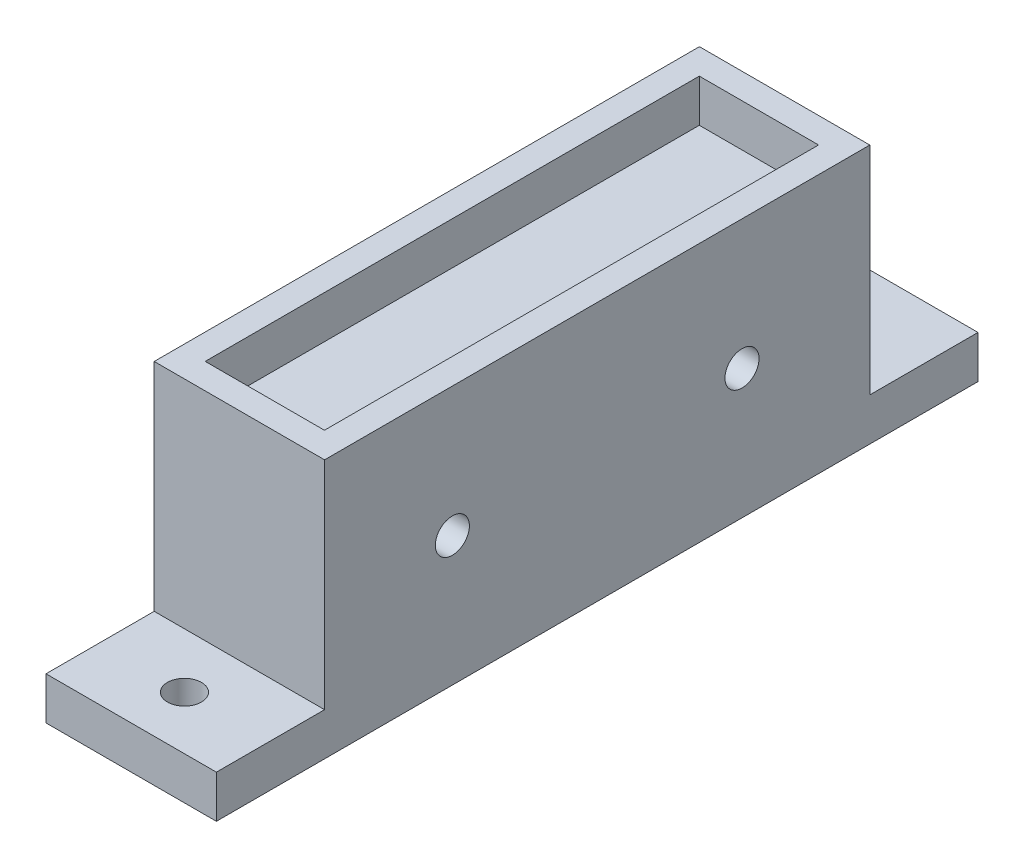
from build123d import *

# Parameters (mm, degrees)
BOSS_EXTRUDE1_DEPTH     = 20
SKETCH4_W               = 14
SKETCH4_H               = 58
CUT_EXTRUDE1_DEPTH      = 5
SKETCH5_R               = 2
CUT_EXTRUDE2_DEPTH      = 5
CUT_EXTRUDE3_DEPTH      = 97.522121817
CUT_EXTRUDE3_DEPTH_BACK = 5
SKETCH6_R               = 2


with BuildPart() as part:
    # Sketch1 → Boss-Extrude1 (new body)
    with BuildSketch(Plane(origin=(0, 0, 0), x_dir=(0, 0, -1), z_dir=(1, 0, 0))):
        Polygon((0, 0), (0, 5), (12.7, 5), (12.7, 30.4), (76.7, 30.4), (76.7, 5), (89.4, 5), (89.4, 0), align=None)
    extrude(amount=BOSS_EXTRUDE1_DEPTH)

    # Sketch4 → Cut-Extrude1 (cut)
    with BuildSketch(Plane(origin=(0, 30.4, 0), x_dir=(1, 0, 0), z_dir=(0, 1, 0))):
        with Locations((9.986416009, 44.7)):
            Rectangle(SKETCH4_W, SKETCH4_H)
    extrude(amount=-CUT_EXTRUDE1_DEPTH, mode=Mode.SUBTRACT)

    # Sketch5 → Cut-Extrude2 (cut)
    with BuildSketch(Plane(origin=(0, 5, 0), x_dir=(1, 0, 0), z_dir=(0, 1, 0))):
        with Locations(Location((10, 83.15, 0), (0, 0, 270))):
            Circle(SKETCH5_R)
        with Locations(Location((10, 6.25, 0), (0, 0, 270))):
            Circle(SKETCH5_R)
    extrude(amount=-CUT_EXTRUDE2_DEPTH, mode=Mode.SUBTRACT)

    # Sketch6 → Cut-Extrude3 (cut, two sides: drawn at the far end of the back side and taken through both)
    with BuildSketch(Plane(origin=(0, 0, 0), x_dir=(0, 0, -1), z_dir=(1, 0, 0)).offset(-CUT_EXTRUDE3_DEPTH_BACK)):
        with Locations(Location((27.7, 15.2, 0), (0, 0, 180))):
            Circle(SKETCH6_R)
        with Locations(Location((61.7, 15.2, 0), (0, 0, 180))):
            Circle(SKETCH6_R)
    extrude(amount=CUT_EXTRUDE3_DEPTH + CUT_EXTRUDE3_DEPTH_BACK, mode=Mode.SUBTRACT)


solid = part.part
